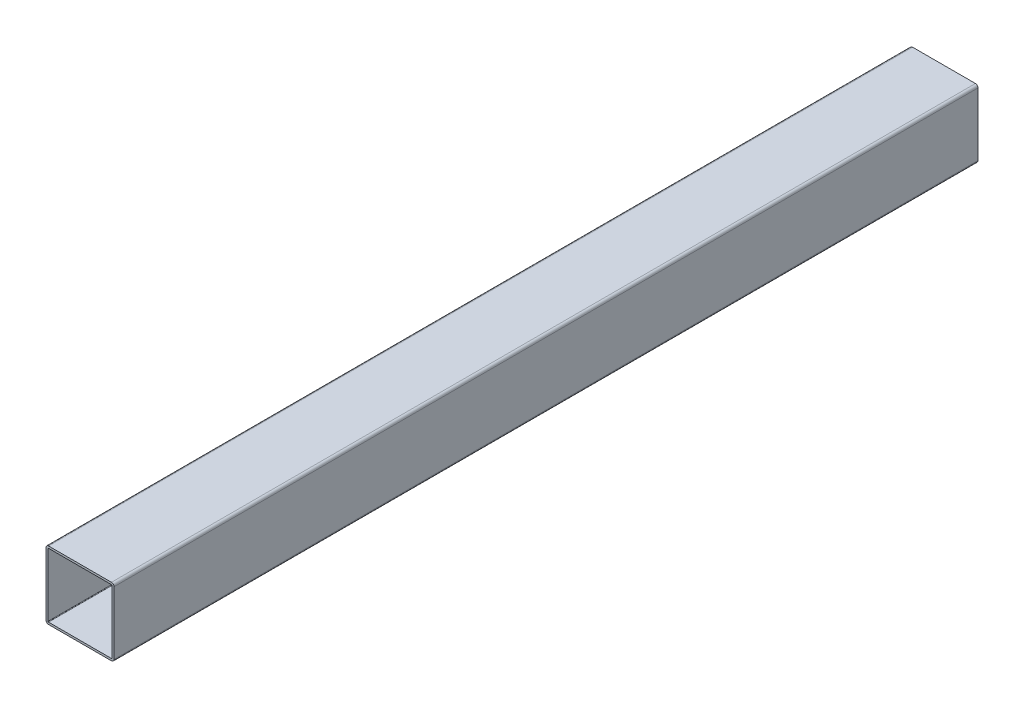
from build123d import *

# Parameters (mm, degrees)
STRUCTURAL_MEMBER1_DEPTH = 508


with BuildPart() as part:
    # Sketch12 → Structural Member1 (new body)
    with BuildSketch(Plane(origin=(0, 0, 0), x_dir=(-1, 0, 0), z_dir=(0, 0, -1))):
        with BuildLine():
            Line((-18.5, -20), (18.5, -20))
            ThreePointArc((18.5, -20), (19.560660172, -19.560660172), (20, -18.5))
            Line((20, -18.5), (20, 18.5))
            ThreePointArc((20, 18.5), (19.560660172, 19.560660172), (18.5, 20))
            Line((18.5, 20), (-18.5, 20))
            ThreePointArc((-18.5, 20), (-19.560660172, 19.560660172), (-20, 18.5))
            Line((-20, 18.5), (-20, -18.5))
            ThreePointArc((-20, -18.5), (-19.560660172, -19.560660172), (-18.5, -20))
        make_face()
        with BuildLine():
            Line((-18.5, -18.8), (18.5, -18.8))
            ThreePointArc((18.5, -18.8), (18.712132034, -18.712132034), (18.8, -18.5))
            Line((18.8, -18.5), (18.8, 18.5))
            ThreePointArc((18.8, 18.5), (18.712132034, 18.712132034), (18.5, 18.8))
            Line((18.5, 18.8), (-18.5, 18.8))
            ThreePointArc((-18.5, 18.8), (-18.712132034, 18.712132034), (-18.8, 18.5))
            Line((-18.8, 18.5), (-18.8, -18.5))
            ThreePointArc((-18.8, -18.5), (-18.712132034, -18.712132034), (-18.5, -18.8))
        make_face(mode=Mode.SUBTRACT)
    extrude(amount=STRUCTURAL_MEMBER1_DEPTH)


solid = part.part
